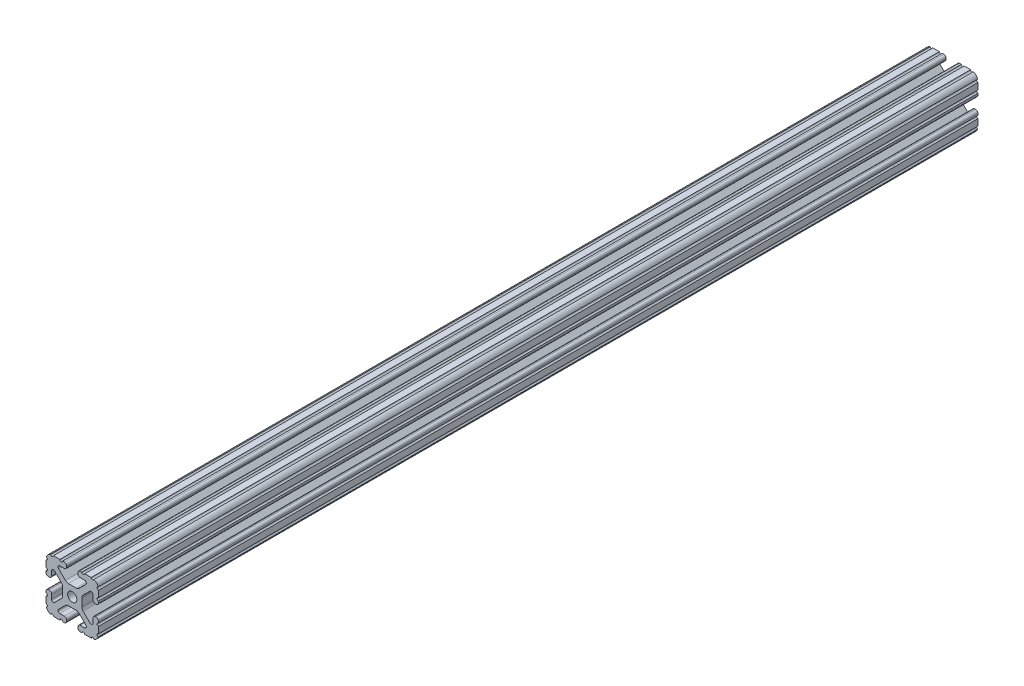
from build123d import *

# Parameters (mm, degrees)
BOSS_EXTRUDE1_DEPTH     = 319.151
CUT_EXTRUDE1_DEPTH      = 321.286068696
CUT_EXTRUDE1_DEPTH_BACK = 321.286068696
SKETCH5_R               = 1.016


with BuildPart() as part:
    # Sketch4 → Boss-Extrude1 (new, symmetric)
    with BuildSketch(Plane.XY):
        with BuildLine():
            Line((5.7912, -19.05), (14.3002, -19.05))
            ThreePointArc((14.3002, -19.05), (17.658815789, -17.658815789), (19.05, -14.3002))
            Line((19.05, -14.3002), (19.05, -5.7912))
            ThreePointArc((19.05, -5.7912), (18.544114832, -4.569885168), (17.3228, -4.064))
            Line((17.3228, -4.064), (16.7132, -4.064))
            ThreePointArc((16.7132, -4.064), (15.491885168, -4.569885168), (14.986, -5.7912))
            Line((14.986, -5.7912), (14.986, -8.996305235))
            ThreePointArc((14.986, -8.996305235), (14.189232738, -10.188751711), (12.782646215, -9.908964256))
            Line((12.782646215, -9.908964256), (7.888897763, -5.015215804))
            ThreePointArc((7.888897763, -5.015215804), (7.219915375, -4.014012907), (6.985, -2.833013566))
            Line((6.985, -2.833013566), (6.985, 0))
            Line((6.985, 0), (3.3274, 0))
            ThreePointArc((3.3274, 0), (2.352827104, -2.352827104), (0, -3.3274))
            Line((0, -3.3274), (0, -6.985))
            Line((0, -6.985), (2.833013566, -6.985))
            ThreePointArc((2.833013566, -6.985), (4.014012907, -7.219915375), (5.015215804, -7.888897763))
            Line((5.015215804, -7.888897763), (9.908964256, -12.782646215))
            ThreePointArc((9.908964256, -12.782646215), (10.188751711, -14.189232738), (8.996305235, -14.986))
            Line((8.996305235, -14.986), (5.7912, -14.986))
            ThreePointArc((5.7912, -14.986), (4.569885168, -15.491885168), (4.064, -16.7132))
            Line((4.064, -16.7132), (4.064, -17.3228))
            ThreePointArc((4.064, -17.3228), (4.569885168, -18.544114832), (5.7912, -19.05))
        make_face()
    extrude(amount=BOSS_EXTRUDE1_DEPTH, both=True)

    # Sketch5 → Cut-Extrude1 (cut, two sides: drawn at the far end of the back side and taken through both)
    with BuildSketch(Plane.XY.offset(-CUT_EXTRUDE1_DEPTH_BACK)):
        with Locations((14.739477062, -19.05)):
            Circle(SKETCH5_R)
        with Locations((7.980305235, -19.05)):
            Circle(SKETCH5_R)
        with Locations((19.05, -14.739477062)):
            Circle(SKETCH5_R)
        with Locations((19.05, -7.980305235)):
            Circle(SKETCH5_R)
    extrude(amount=CUT_EXTRUDE1_DEPTH + CUT_EXTRUDE1_DEPTH_BACK, mode=Mode.SUBTRACT)

    # Mirror1: part across plane


with BuildPart() as part_1:
    add(part.part)
    add(part.part.mirror(Plane(origin=(0, 0, 0), x_dir=(0, 0, 1), z_dir=(1, 0, 0))))

    # Mirror2: part across plane


with BuildPart() as part_2:
    add(part_1.part)
    add(part_1.part.mirror(Plane.ZX))


solid = part_2.part
